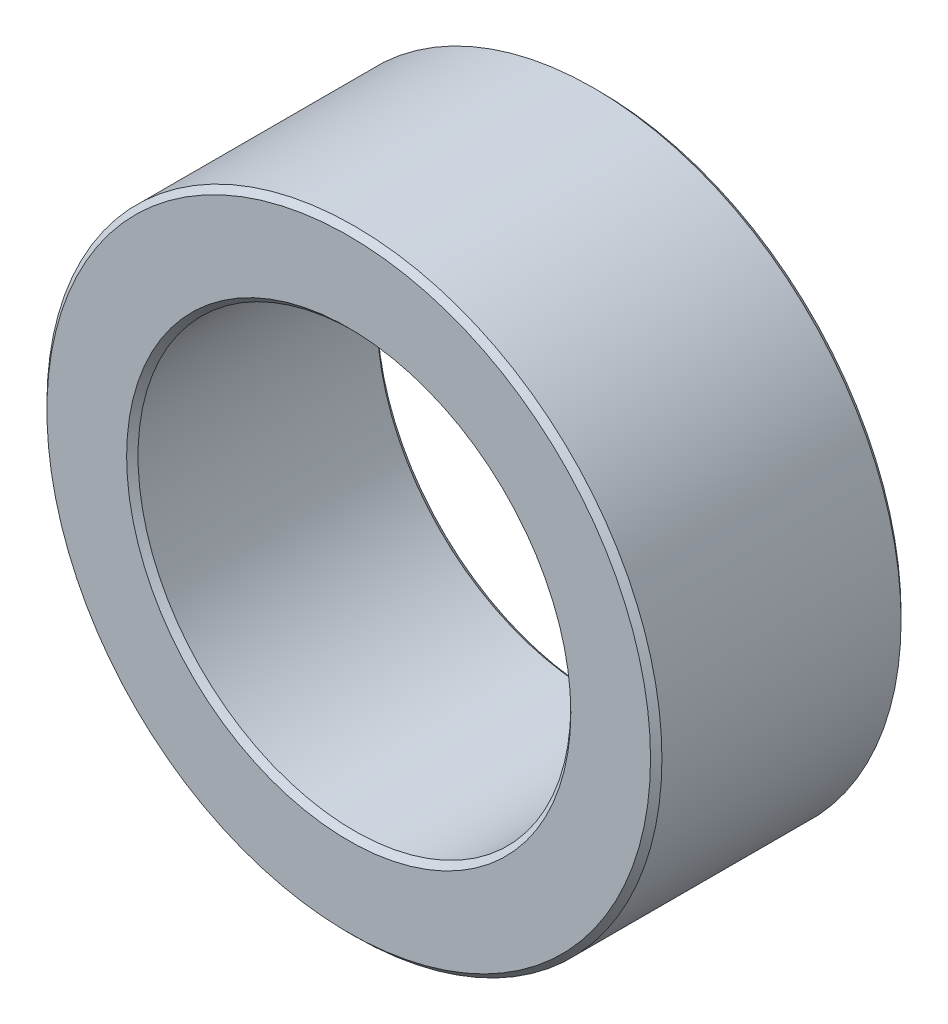
from build123d import *

# Parameters (mm, degrees)
SKIZZE1_R                       = 27
SKIZZE1_R_2                     = 19
AUFSATZ_LINEAR_AUSTRAGEN1_DEPTH = 11
FASE1_SIZE                      = 0.5


with BuildPart() as part:
    # Skizze1 → Aufsatz-Linear austragen1 (new, symmetric)
    with BuildSketch(Plane.XY):
        Circle(SKIZZE1_R)
        Circle(SKIZZE1_R_2, mode=Mode.SUBTRACT)
    extrude(amount=AUFSATZ_LINEAR_AUSTRAGEN1_DEPTH, both=True)

    # Fase1
    fase1_edges = [part.edges().sort_by_distance(p)[0] for p in [
        (-19, 0, -11),
        (-27, 0, -11),
        (-27, 0, 11),
        (-19, 0, 11),
    ]]
    chamfer(fase1_edges, length=FASE1_SIZE)


solid = part.part
